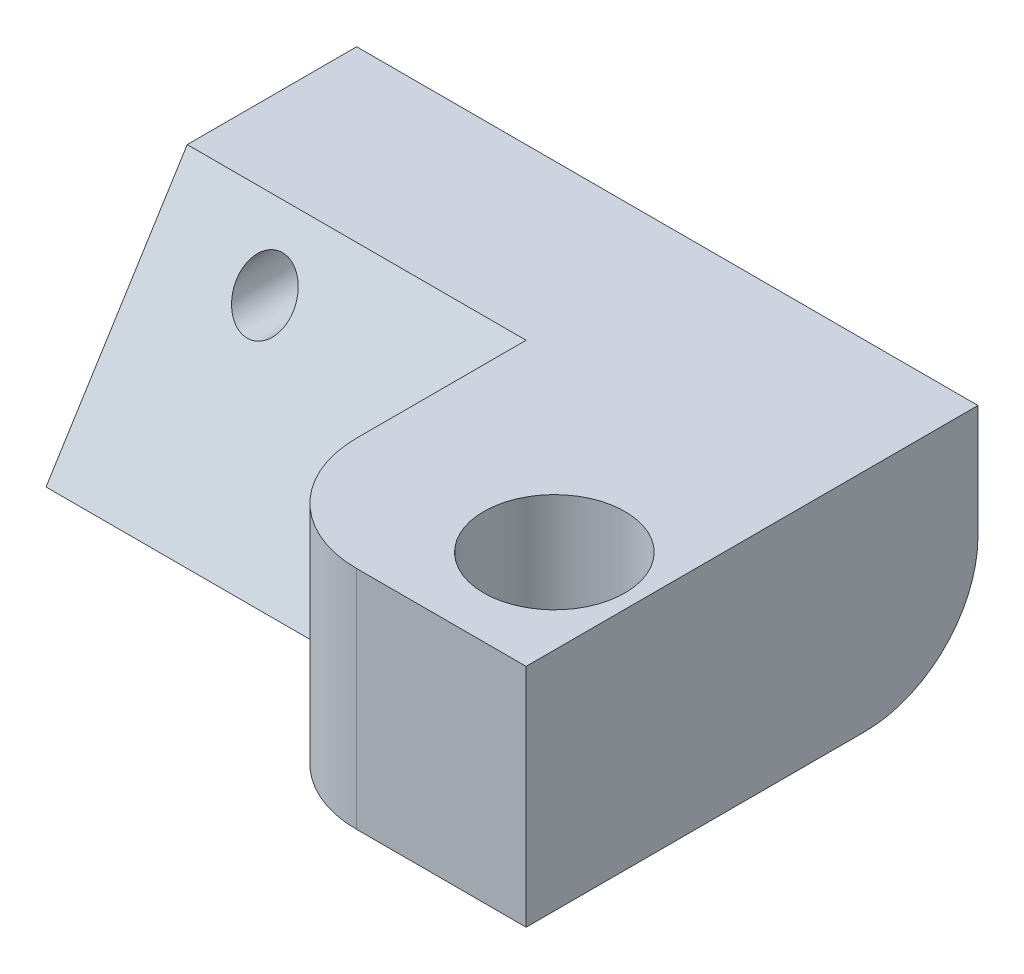
from build123d import *

# Parameters (mm, degrees)
BOSS_EXTRUDE3_DEPTH = 50.8
CUT_EXTRUDE1_DEPTH  = 76.2
SKETCH7_R           = 6.35
CUT_EXTRUDE2_DEPTH  = 76.2
SKETCH8_R           = 9.525
CUT_EXTRUDE3_DEPTH  = 76.2
SKETCH9_R           = 15.875
CUT_EXTRUDE4_DEPTH  = 25.4
FILLET1_R           = 25.4


with BuildPart() as part:
    # Sketch2 → Boss-Extrude3 (new body)
    with BuildSketch(Plane(origin=(0, 0, 0), x_dir=(1, 0, 0), z_dir=(0, 1, 0))):
        Polygon((76.2, -101.6), (0, -101.6), (0, -50.8), (0, 0), (139.7, 0), (139.7, -28.821295133), (139.7, -101.6), align=None)
    extrude(amount=BOSS_EXTRUDE3_DEPTH)

    # Sketch5 → Cut-Extrude1 (cut)
    with BuildSketch(Plane.ZY):
        Polygon((69.85, 0), (101.6, 0), (101.6, 50.8), (38.1, 50.8), align=None)
    extrude(amount=-CUT_EXTRUDE1_DEPTH, mode=Mode.SUBTRACT)

    # Sketch7 → Cut-Extrude2 (cut)
    with BuildSketch(Plane(origin=(0, 0, 0), x_dir=(-1, 0, 0), z_dir=(0, 0, -1))):
        with Locations((-25.4, 38.1)):
            Circle(SKETCH7_R)
    extrude(amount=-CUT_EXTRUDE2_DEPTH, mode=Mode.SUBTRACT)

    # Sketch8 → Cut-Extrude3 (cut)
    with BuildSketch(Plane(origin=(0, 50.8, 0), x_dir=(1, 0, 0), z_dir=(0, 1, 0))):
        with Locations(Location((120.65, -76.2, 0), (0, 0, 270))):
            Circle(SKETCH8_R)
    extrude(amount=-CUT_EXTRUDE3_DEPTH, mode=Mode.SUBTRACT)

    # Sketch9 → Cut-Extrude4 (cut)
    with BuildSketch(Plane(origin=(0, 50.8, 0), x_dir=(1, 0, 0), z_dir=(0, 1, 0))):
        with Locations(Location((120.65, -76.2, 0), (0, 0, 270))):
            Circle(SKETCH9_R)
    extrude(amount=-CUT_EXTRUDE4_DEPTH, mode=Mode.SUBTRACT)

    # Fillet1
    fillet1_edges = [part.edges().sort_by_distance(p)[0] for p in [
        (76.2, 25.4, 101.6),
        (69.85, 0, 0),
    ]]
    fillet(fillet1_edges, radius=FILLET1_R)


solid = part.part
